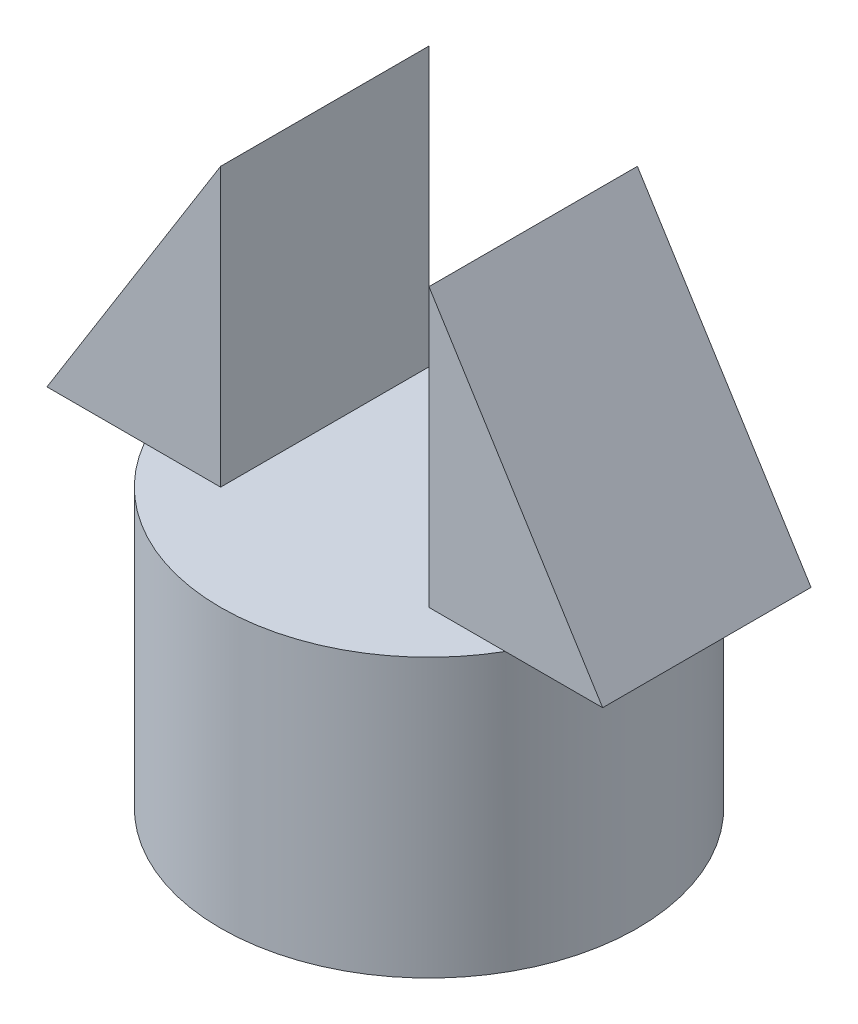
from build123d import *

# Parameters (mm, degrees)
SKETCH_1_R      = 30
EXTRUDE_1_DEPTH = 40
EXTRUDE_2_DEPTH = 15


with BuildPart() as part:
    # 草图1 → 凸台-拉伸1 (new body)
    with BuildSketch(Plane(origin=(0, 0, 0), x_dir=(1, 0, 0), z_dir=(0, 1, 0))):
        with Locations(Location((0, 0, 0), (0, 0, 270))):
            Circle(SKETCH_1_R)
    extrude(amount=EXTRUDE_1_DEPTH)

    # 草图2 → 凸台-拉伸2 (add, symmetric)
    with BuildSketch(Plane.XY):
        Polygon((-15, 40), (-15, 80), (-40, 40), align=None)
        Polygon((15, 40), (40, 40), (15, 80), align=None)
    extrude(amount=EXTRUDE_2_DEPTH, both=True)


solid = part.part
